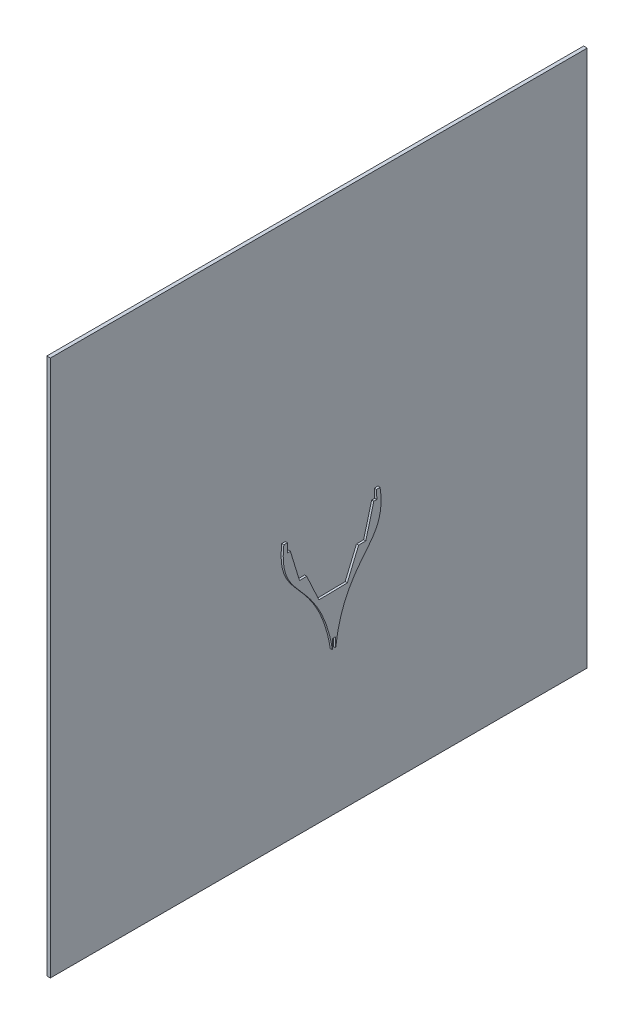
from build123d import *

# Parameters (mm, degrees)
BOSS_EXTRU_2_DEPTH      = 10
BOSS_EXTRU_3_DEPTH      = 6
ENL_V_MAT_EXTRU_1_DEPTH = 6


with BuildPart() as part:
    # Esquisse3D1 → Boss.-Extru.2 (new body)
    with BuildSketch(Plane(origin=(-20, 1121.289346724, 777.274991403), x_dir=(0, -0.7071067811865476, -0.7071067811865476), z_dir=(1, 0, 0))):
        Polygon((0, 0), (1060.66017178, 1060.66017178), (2121.32034356, 0), (1060.66017178, -1060.66017178), align=None)
    extrude(amount=BOSS_EXTRU_2_DEPTH)


with BuildPart() as body_2:
    # Esquisse5 → Boss.-Extru.3 (new body)
    with BuildSketch(Plane(origin=(0, 0, 0), x_dir=(0, 0, -1), z_dir=(1, 0, 0))):
        with BuildLine():
            Line((127.903623433, 364.021786679), (117.903623433, 363.840632906))
            Line((117.903623433, 363.840632906), (118.937146978, 338.999069943))
            Line((118.937146978, 338.999069943), (110.549236226, 338.847119775))
            Line((110.549236226, 338.847119775), (87.996944079, 254.215348918))
            Line((87.996944079, 254.215348918), (68.013658913, 253.853344169))
            Line((68.013658913, 253.853344169), (36.394423086, 178.51752917))
            Line((36.394423086, 178.51752917), (-42.836246978, 177.082235691))
            Line((-42.836246978, 177.082235691), (-77.163314831, 251.22340852))
            Line((-77.163314831, 251.22340852), (-97.146599997, 250.861403771))
            Line((-97.146599997, 250.861403771), (-122.749362163, 334.620827652))
            Line((-122.749362163, 334.620827652), (-131.137272915, 334.468877484))
            Line((-131.137272915, 334.468877484), (-131.004160791, 359.331574493))
            Line((-131.004160791, 359.331574493), (-141.004160791, 359.150420721))
            add(Edge.make_bspline(
                [(0, 0), (-4.612294832, 18.064961959), (-12.120544798, 267.002875028), (-160.999534843, 184.373215516), (-141.004160791, 359.150420721)],
                knots=[0, 0, 0, 0, 0, 1, 1, 1, 1, 1], degree=4))
            add(Edge.make_bspline(
                [(0, 0), (3.954976136, 18.220161304), (2.442050218, 267.26668193), (154.216110794, 190.083465854), (127.903623433, 364.021786679)],
                knots=[0, 0, 0, 0, 0, 1, 1, 1, 1, 1], degree=4))
        make_face()
    extrude(amount=BOSS_EXTRU_3_DEPTH)

    # Esquisse6 → Enlèv. mat.-Extru.1 (cut)
    with BuildSketch(Plane(origin=(6, 0, 0), x_dir=(0, 0, -1), z_dir=(1, 0, 0))):
        Polygon((-5.178565587, 37.37646897), (-5.667680773, 64.37646897), (3.332319227, 64.539507366), (3.821434413, 37.539507366), (117.063261114, -47.52702125), (-85.227699586, -65.220017949), align=None)
    extrude(amount=-ENL_V_MAT_EXTRU_1_DEPTH, mode=Mode.SUBTRACT)


solid = Compound([part.part, body_2.part])
